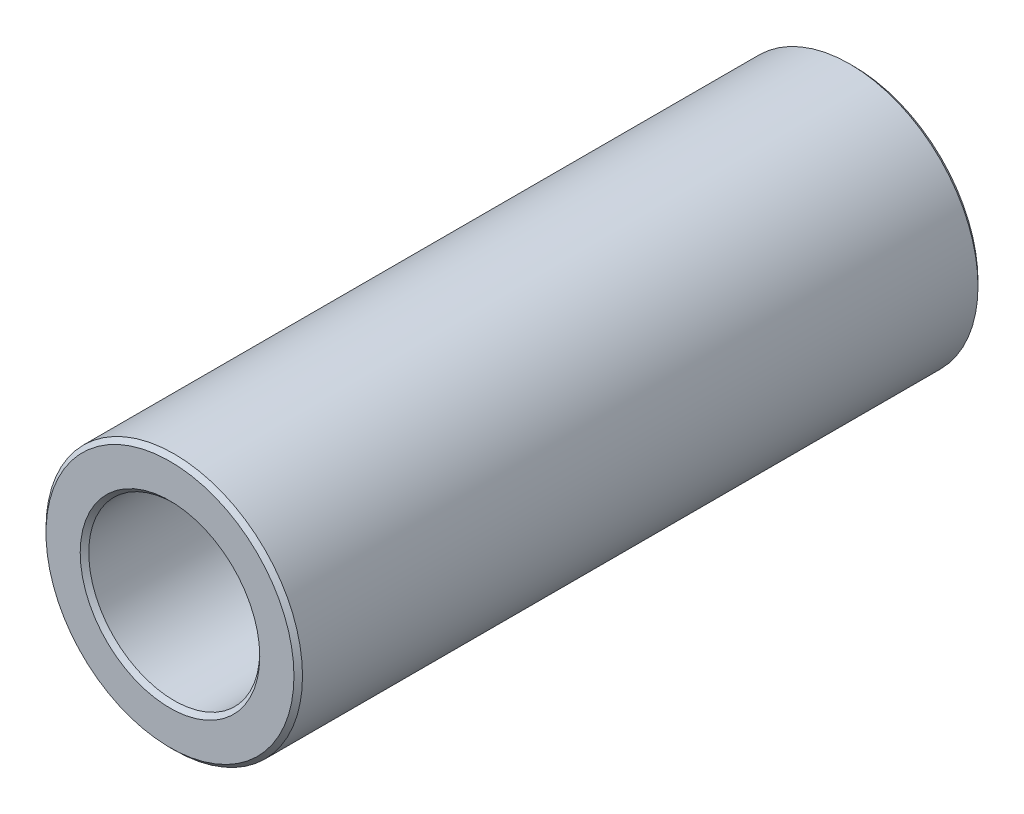
from build123d import *

# Parameters (mm, degrees)
BOSS_EXTRUDE1_DEPTH      = 12.7
BOSS_EXTRUDE1_DEPTH_BACK = 12.7
SKETCH3_R                = 4.7625
SKETCH3_R_2              = 3.175
CHAMFER1_SIZE            = 0.15875


with BuildPart() as part:
    # Sketch3 → Boss-Extrude1 (new, two sides: drawn at the far end of the back side and taken through both)
    with BuildSketch(Plane.XY.offset(-BOSS_EXTRUDE1_DEPTH_BACK)):
        Circle(SKETCH3_R)
        Circle(SKETCH3_R_2, mode=Mode.SUBTRACT)
    extrude(amount=BOSS_EXTRUDE1_DEPTH + BOSS_EXTRUDE1_DEPTH_BACK)

    # Chamfer1
    chamfer1_edges = [part.edges().sort_by_distance(p)[0] for p in [
        (-4.7625, 0, -12.7),
        (-3.175, 0, -12.7),
        (-4.7625, 0, 12.7),
        (-3.175, 0, 12.7),
    ]]
    chamfer(chamfer1_edges, length=CHAMFER1_SIZE)


solid = part.part
